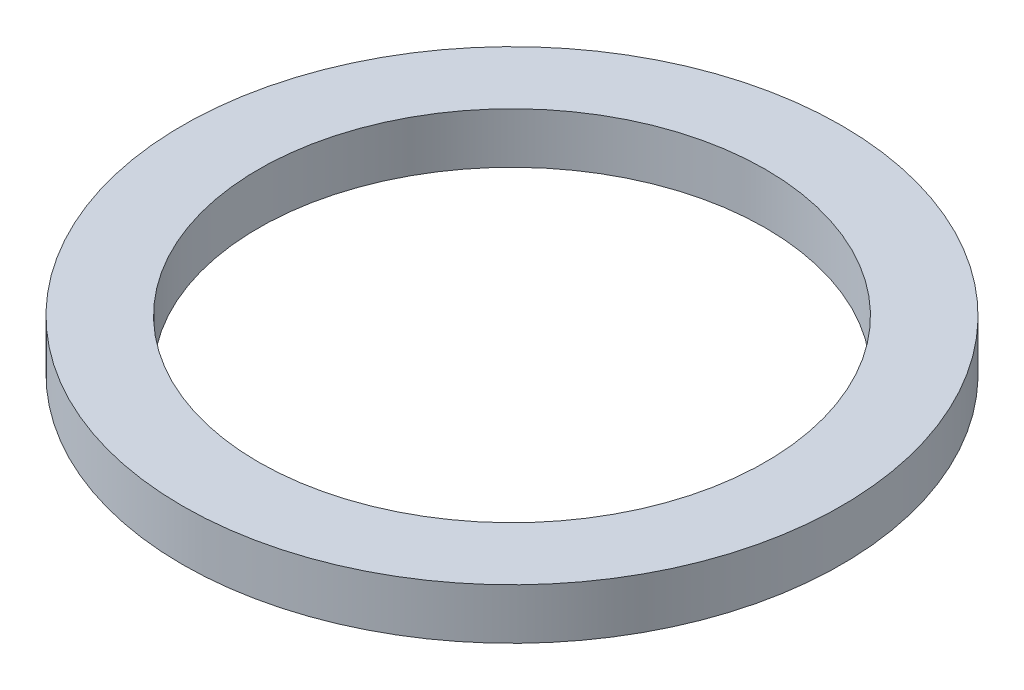
from build123d import *

# Parameters (mm, degrees)
SKETCH_1_R        = 26
SKETCH_1_R_2      = 20
EXTRUDE_304_DEPTH = 4


with BuildPart() as part:
    # Эскиз1 → Extrude 304 (new body)
    with BuildSketch(Plane(origin=(0, 0, 0), x_dir=(1, 0, 0), z_dir=(0, 1, 0))):
        with Locations(Location((0, 0, 0), (0, 0, 270))):
            Circle(SKETCH_1_R)
        with Locations(Location((0, 0, 0), (0, 0, 270))):
            Circle(SKETCH_1_R_2, mode=Mode.SUBTRACT)
    extrude(amount=EXTRUDE_304_DEPTH)


solid = part.part
